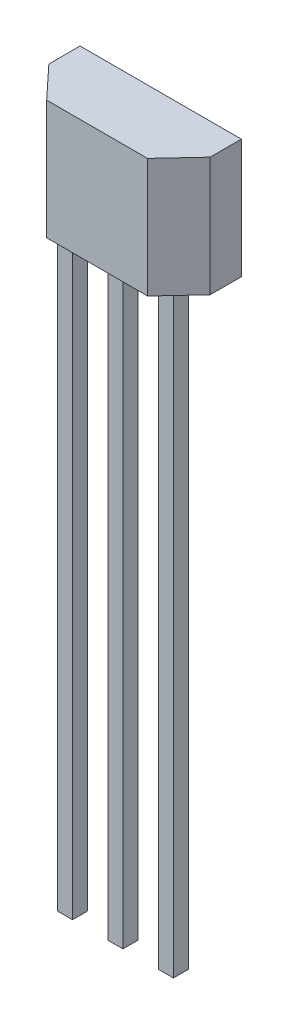
from build123d import *

# Parameters (mm, degrees)
BOSS_EXTRUDE1_DEPTH = 3
SKETCH3_W           = 0.38
SKETCH3_H           = 0.38
BOSS_EXTRUDE2_DEPTH = 15


with BuildPart() as part:
    # PROF_TOP_VIEW → Boss-Extrude1 (new body)
    with BuildSketch(Plane(origin=(0, 0, 0), x_dir=(1, 0, 0), z_dir=(0, 1, 0))):
        Polygon((-2.03, 0), (2.03, 0), (2.03, -0.78499978), (1.27, -1.6), (-1.27, -1.6), (-2.03, -0.78499978), align=None)
    extrude(amount=-BOSS_EXTRUDE1_DEPTH)

    # Sketch3 → Boss-Extrude2 (add)
    with BuildSketch(Plane.XZ.offset(3)):
        with Locations((-1.27, 0.95)):
            Rectangle(SKETCH3_W, SKETCH3_H)
        with Locations((0, 0.95)):
            Rectangle(SKETCH3_W, SKETCH3_H)
        with Locations((1.27, 0.95)):
            Rectangle(SKETCH3_W, SKETCH3_H)
    extrude(amount=BOSS_EXTRUDE2_DEPTH)


solid = part.part
